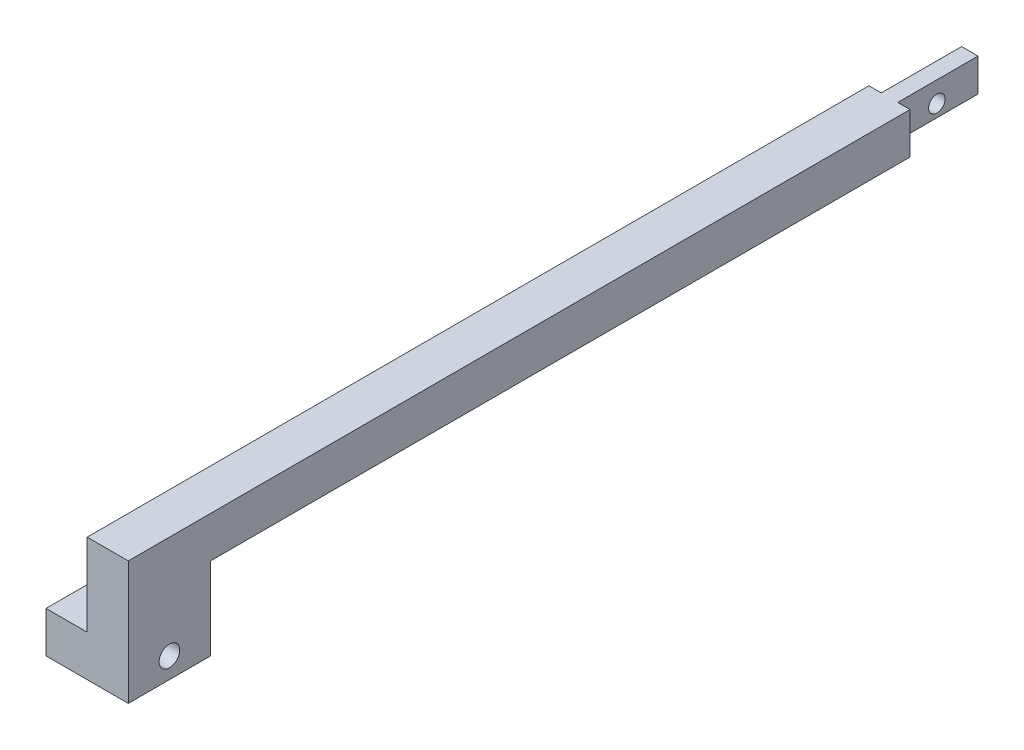
from build123d import *

# Parameters (mm, degrees)
BOSS_EXTRUDE1_DEPTH = 190
SKETCH3_W           = 170
SKETCH3_H           = 20
CUT_EXTRUDE1_DEPTH  = 190
SKETCH4_W           = 4
SKETCH4_H           = 5
BOSS_EXTRUDE2_DEPTH = 19.5
SKETCH5_R           = 2.75
CUT_EXTRUDE3_DEPTH  = 10
SKETCH7_W           = 4
SKETCH7_H           = 19.5
BOSS_EXTRUDE3_DEPTH = 3
BOSS_EXTRUDE4_REACH = 195.391
SKETCH8_R           = 2.75
SKETCH8_R_2         = 2.5
SKETCH9_R           = 2.5
CUT_EXTRUDE4_DEPTH  = 194.390796058
SKETCH10_R          = 2
CUT_EXTRUDE5_DEPTH  = 193.792634714


with BuildPart() as part:
    # Sketch2 → Boss-Extrude1 (new body)
    with BuildSketch(Plane.XY):
        Polygon((0, 0), (0, 10), (10, 10), (10, 30), (20, 30), (20, 0), align=None)
    extrude(amount=BOSS_EXTRUDE1_DEPTH)

    # Sketch3 → Cut-Extrude1 (cut)
    with BuildSketch(Plane(origin=(20, 0, 0), x_dir=(0, 0, -1), z_dir=(1, 0, 0))):
        with Locations((-85, 10)):
            Rectangle(SKETCH3_W, SKETCH3_H)
    extrude(amount=-CUT_EXTRUDE1_DEPTH, mode=Mode.SUBTRACT)

    # Sketch4 → Boss-Extrude2 (add)
    with BuildSketch(Plane(origin=(0, 0, 0), x_dir=(-1, 0, 0), z_dir=(0, 0, -1))):
        with Locations((-15, 27.5)):
            Rectangle(SKETCH4_W, SKETCH4_H)
    extrude(amount=BOSS_EXTRUDE2_DEPTH)

    # Sketch5 → Cut-Extrude3 (cut)
    with BuildSketch(Plane.ZY):
        with Locations((180, 5)):
            Circle(SKETCH5_R)
    extrude(amount=-CUT_EXTRUDE3_DEPTH, mode=Mode.SUBTRACT)

    # Sketch7 → Boss-Extrude3 (add)
    with BuildSketch(Plane.XZ.offset(-25)):
        with Locations((15, -9.75)):
            Rectangle(SKETCH7_W, SKETCH7_H)
    extrude(amount=BOSS_EXTRUDE3_DEPTH)

    # Sketch8 → Boss-Extrude4 (add, up to next)
    with BuildSketch(Plane.ZY, mode=Mode.PRIVATE) as boss_extrude4_sk1:
        with Locations((180, 5)):
            Circle(SKETCH8_R)
        with Locations((180, 5)):
            Circle(SKETCH8_R_2, mode=Mode.SUBTRACT)
    boss_extrude4_tool1 = extrude(boss_extrude4_sk1.sketch, amount=-BOSS_EXTRUDE4_REACH, mode=Mode.PRIVATE) - part.part
    add(boss_extrude4_tool1.solids().sort_by_distance((0, 5, 177.327782))[0])

    # Sketch9 → Cut-Extrude4 (cut, through all)
    with BuildSketch(Plane.ZY):
        with Locations((180, 5)):
            Circle(SKETCH9_R)
    extrude(amount=-CUT_EXTRUDE4_DEPTH, mode=Mode.SUBTRACT)

    # Sketch10 → Cut-Extrude5 (cut, through all)
    with BuildSketch(Plane.ZY.offset(-13)):
        with Locations((-9.5, 25)):
            Circle(SKETCH10_R)
    extrude(amount=-CUT_EXTRUDE5_DEPTH, mode=Mode.SUBTRACT)


solid = part.part
